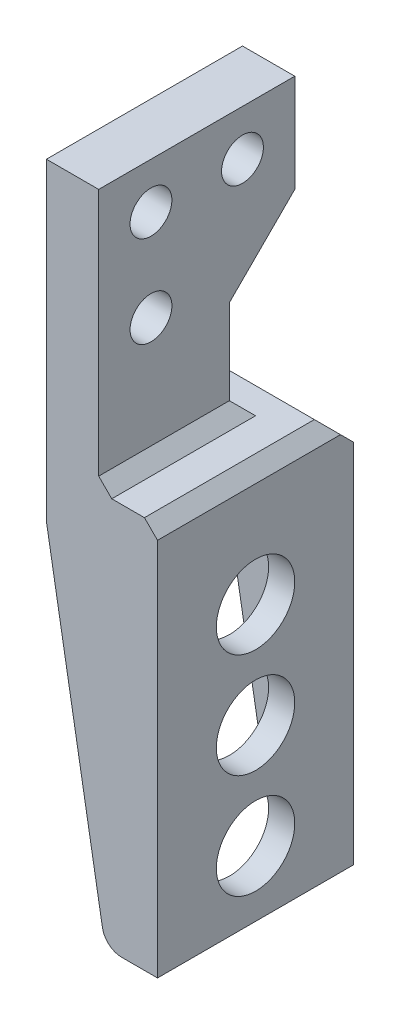
from build123d import *

# Parameters (mm, degrees)
DODANIE_WYCI_GNI_CIE1_DEPTH = 7.5
SZKIC2_W                    = 6.5
SZKIC2_H                    = 11
WYTNIJ_WYCI_GNI_CIE1_DEPTH  = 26
WYTNIJ_WYCI_GNI_CIE2_REACH  = 53.269
SZKIC4_R                    = 1.6
SZKIC4_R_2                  = 3
WYTNIJ_WYCI_GNI_CIE3_DEPTH  = 52.268898954
ZAOKR_GLENIE1_R             = 3
ZAOKR_GLENIE2_R             = 1.5
SFAZOWANIE2_SIZE            = 1
SFAZOWANIE3_SIZE            = 2


with BuildPart() as part:
    # Szkic1 → Dodanie-wyciągnięcie1 (new, symmetric)
    with BuildSketch(Plane.XY):
        Polygon((0, 0), (4, 0), (4, -20), (8.5, -20), (8.5, -50), (4.5, -50), (0, -24), align=None)
    extrude(amount=DODANIE_WYCI_GNI_CIE1_DEPTH, both=True)

    # Szkic2 → Wytnij-wyciągnięcie1 (cut)
    with BuildSketch(Plane.XZ.offset(50)):
        with Locations((3.25, 0)):
            Rectangle(SZKIC2_W, SZKIC2_H)
    extrude(amount=-WYTNIJ_WYCI_GNI_CIE1_DEPTH, mode=Mode.SUBTRACT)

    # Szkic3 → Wytnij-wyciągnięcie2 (cut, up to next)
    with BuildSketch(Plane.ZY, mode=Mode.PRIVATE) as wytnij_wyci_gni_cie2_sk1:
        Polygon((-7.5, -7.5), (-7.5, -20), (-2.5, -20), (-2.5, -12.5), align=None)
    wytnij_wyci_gni_cie2_tool1 = extrude(wytnij_wyci_gni_cie2_sk1.sketch, amount=-WYTNIJ_WYCI_GNI_CIE2_REACH, mode=Mode.PRIVATE) & part.part
    add(wytnij_wyci_gni_cie2_tool1.solids().sort_by_distance((0, -14.895833, -5.208333))[0], mode=Mode.SUBTRACT)

    # Szkic4 → Wytnij-wyciągnięcie3 (cut, through all)
    with BuildSketch(Plane.ZY):
        with Locations((-3.5, -3.5)):
            Circle(SZKIC4_R)
        with Locations((3.5, -3.5)):
            Circle(SZKIC4_R)
        with Locations((0, -29)):
            Circle(SZKIC4_R_2)
        with Locations((0, -37)):
            Circle(SZKIC4_R_2)
        with Locations((0, -45)):
            Circle(SZKIC4_R_2)
        with Locations((3.5, -10.5)):
            Circle(SZKIC4_R)
    extrude(amount=-WYTNIJ_WYCI_GNI_CIE3_DEPTH, mode=Mode.SUBTRACT)

    # Zaokrąglenie1
    zaokr_glenie1_edges = [part.edges().sort_by_distance(p)[0] for p in [
        (3.25, -24, -5.5),
        (3.25, -24, 5.5),
    ]]
    fillet(zaokr_glenie1_edges, radius=ZAOKR_GLENIE1_R)

    # Zaokrąglenie2
    zaokr_glenie2_edges = [part.edges().sort_by_distance(p)[0] for p in [
        (4.5, -50, 6.5),
        (4.5, -50, -6.5),
    ]]
    fillet(zaokr_glenie2_edges, radius=ZAOKR_GLENIE2_R)

    # Sfazowanie2
    sfazowanie2_edges = [part.edges().sort_by_distance(p)[0] for p in [
        (4, -20, 2.5),
        (8.5, -20, 0),
        (2, -20, -2.5),
    ]]
    chamfer(sfazowanie2_edges, length=SFAZOWANIE2_SIZE)

    # Sfazowanie3
    sfazowanie3_edges = [part.edges().sort_by_distance(p)[0] for p in [
        (3.75, -20, -7.5),
    ]]
    chamfer(sfazowanie3_edges, length=SFAZOWANIE3_SIZE)


solid = part.part
